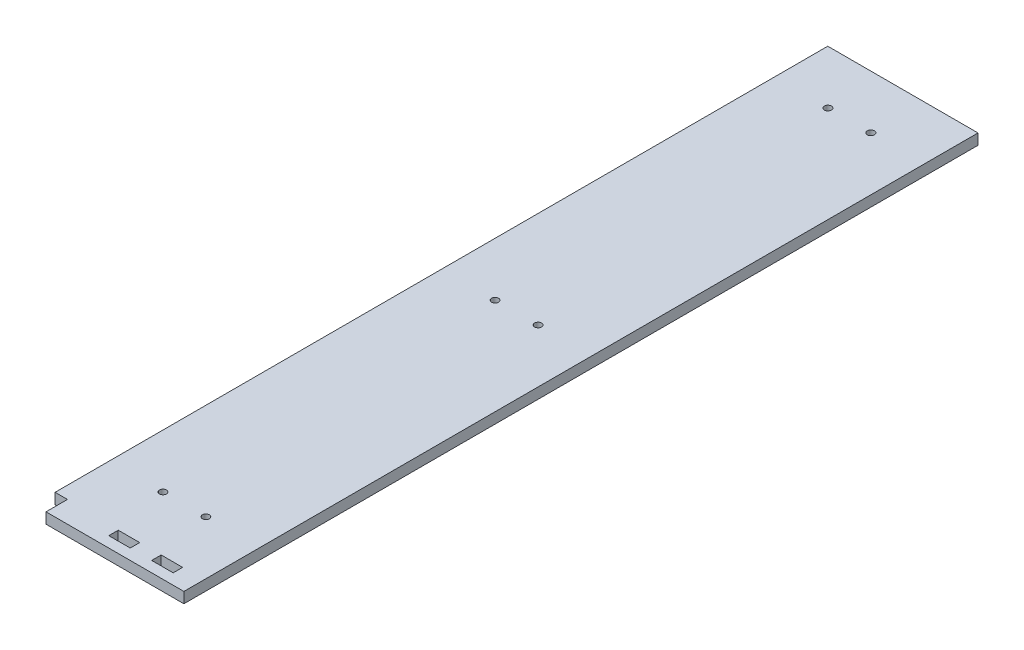
from build123d import *

# Parameters (mm, degrees)
SKETCH1_W           = 88.9
SKETCH1_H           = 6.35
BOSS_EXTRUDE1_DEPTH = 457.2
SKETCH2_R           = 2.06375
CUT_EXTRUDE1_DEPTH  = 460.399570091
SKETCH3_R           = 2.0955
CUT_EXTRUDE2_DEPTH  = 460.399570091
SKETCH4_W           = 81.59065151
SKETCH4_H           = 6.35
BOSS_EXTRUDE2_DEPTH = 12.7
SKETCH5_W           = 12.7
SKETCH5_H           = 5.60664933
CUT_EXTRUDE3_DEPTH  = 12.7


with BuildPart() as part:
    # Sketch1 → Boss-Extrude1 (new body)
    with BuildSketch(Plane.XY):
        with Locations((0, -41.275)):
            Rectangle(SKETCH1_W, SKETCH1_H)
    extrude(amount=-BOSS_EXTRUDE1_DEPTH)

    # Sketch2 → Cut-Extrude1 (cut, through all)
    with BuildSketch(Plane.XZ.offset(44.45)):
        with Locations((-12.7, -228.6)):
            Circle(SKETCH2_R)
        with Locations((12.7, -228.6)):
            Circle(SKETCH2_R)
        with Locations((-12.7, -32.0675)):
            Circle(SKETCH2_R)
        with Locations((12.7, -32.0675)):
            Circle(SKETCH2_R)
    extrude(amount=-CUT_EXTRUDE1_DEPTH, mode=Mode.SUBTRACT)

    # Sketch3 → Cut-Extrude2 (cut, through all)
    with BuildSketch(Plane(origin=(0, -44.45, 0), x_dir=(-1, 0, 0), z_dir=(0, -1, 0))):
        with Locations(Location((12.7, 425.5516, 0), (0, 0, 180))):
            Circle(SKETCH3_R)
        with Locations(Location((-12.7, 425.5516, 0), (0, 0, 180))):
            Circle(SKETCH3_R)
    extrude(amount=-CUT_EXTRUDE2_DEPTH, mode=Mode.SUBTRACT)

    # Sketch4 → Boss-Extrude2 (add)
    with BuildSketch(Plane.XY):
        with Locations((3.654674245, -41.275)):
            Rectangle(SKETCH4_W, SKETCH4_H)
    extrude(amount=BOSS_EXTRUDE2_DEPTH)

    # Sketch5 → Cut-Extrude3 (cut)
    with BuildSketch(Plane.XZ.offset(44.45)):
        with Locations((25.4, 3.546675335)):
            Rectangle(SKETCH5_W, SKETCH5_H)
        with Locations((0, 3.546675335)):
            Rectangle(SKETCH5_W, SKETCH5_H)
    extrude(amount=-CUT_EXTRUDE3_DEPTH, mode=Mode.SUBTRACT)


solid = part.part
